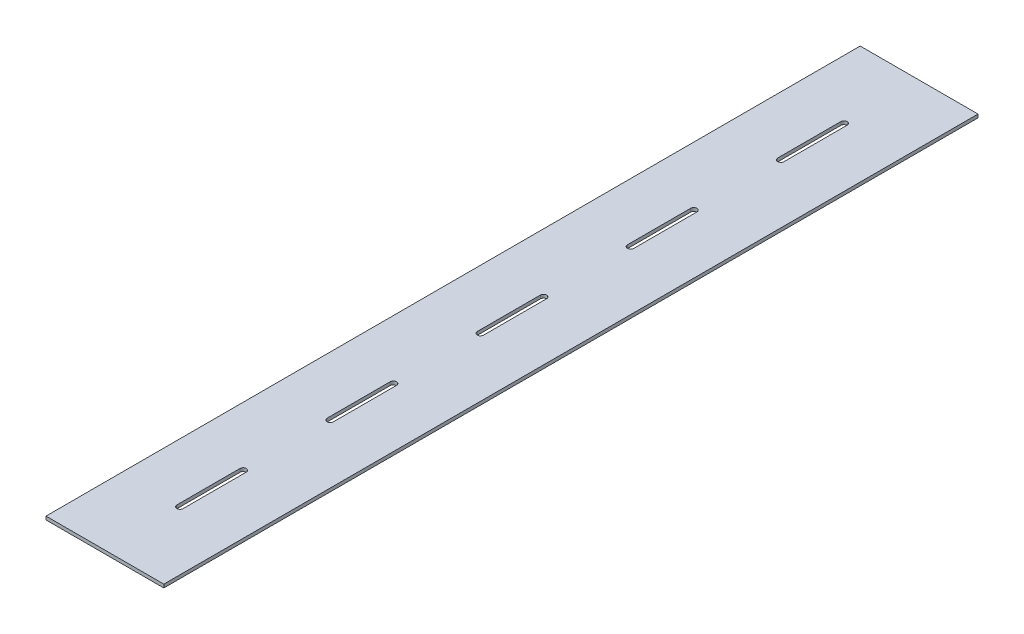
from build123d import *

# Parameters (mm, degrees)
SKETCH_1_W             = 280
SKETCH_1_H             = 1935
EXTRUDE_1_DEPTH        = 8
CUT_EXTRUDE_1_DEPTH    = 8
PATTERN_LINEAR_1_COUNT = 5
PATTERN_LINEAR_1_PITCH = 357


with BuildPart() as part:
    # 草图1 → 凸台-拉伸1 (new body)
    with BuildSketch(Plane(origin=(0, 0, 0), x_dir=(1, 0, 0), z_dir=(0, 1, 0))):
        Rectangle(SKETCH_1_W, SKETCH_1_H)
    extrude(amount=EXTRUDE_1_DEPTH)

    # 草图2 → 切除-拉伸1 (cut)
    with BuildSketch(Plane(origin=(0, 8, 0), x_dir=(1, 0, 0), z_dir=(0, 1, 0))):
        with BuildLine():
            Line((-7.5, -789), (-7.5, -639))
            ThreePointArc((-7.5, -639), (0, -631.5), (7.5, -639))
            Line((7.5, -639), (7.5, -789))
            ThreePointArc((7.5, -789), (0, -796.5), (-7.5, -789))
        make_face()
    cut_extrude_1 = extrude(amount=-CUT_EXTRUDE_1_DEPTH, mode=Mode.SUBTRACT)

    # 阵列(线性)1: 切除-拉伸1 ×5
    with Locations(*[(0, 0, -i * PATTERN_LINEAR_1_PITCH) for i in range(1, PATTERN_LINEAR_1_COUNT)]):
        add(cut_extrude_1, mode=Mode.SUBTRACT)


solid = part.part
